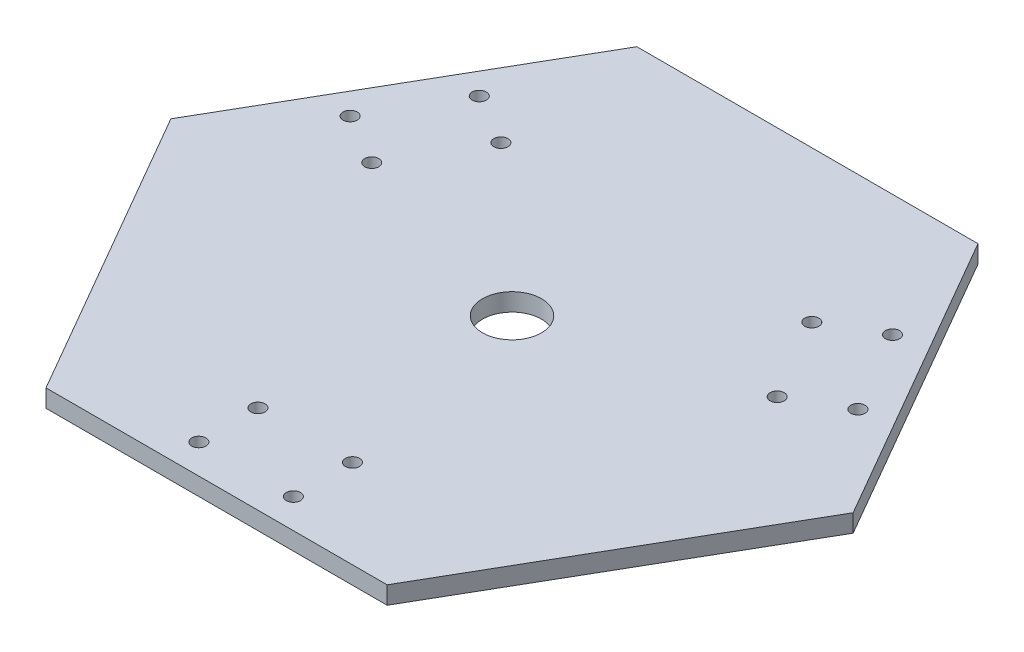
from build123d import *

# Parameters (mm, degrees)
EXTRUDE_1_DEPTH          = 3
SKETCH_2_R               = 5
CUT_EXTRUDE_1_DEPTH      = 3
SKETCH_3_R               = 1.2
CUT_EXTRUDE_2_DEPTH      = 3
PATTERN_CIRCULAR_1_COUNT = 3


with BuildPart() as part:
    # 草图1 → 凸台-拉伸1 (new body)
    with BuildSketch(Plane(origin=(0, 0, 0), x_dir=(1, 0, 0), z_dir=(0, 1, 0))):
        Polygon((28.867513459, 50), (-28.867513459, 50), (-57.735026919, 0), (-28.867513459, -50), (28.867513459, -50), (57.735026919, 0), align=None)
    extrude(amount=EXTRUDE_1_DEPTH)

    # 草图2 → 切除-拉伸1 (cut)
    with BuildSketch(Plane(origin=(0, 3, 0), x_dir=(1, 0, 0), z_dir=(0, 1, 0))):
        with Locations(Location((0, 0, 0), (0, 0, 270))):
            Circle(SKETCH_2_R)
    extrude(amount=-CUT_EXTRUDE_1_DEPTH, mode=Mode.SUBTRACT)

    # 草图3 → 切除-拉伸2 (cut)
    with BuildSketch(Plane.XZ):
        with Locations(Location((-8, 45, 0), (0, 0, 270))):
            Circle(SKETCH_3_R)
        with Locations(Location((8, 45, 0), (0, 0, 270))):
            Circle(SKETCH_3_R)
        with Locations(Location((8, 35, 0), (0, 0, 270))):
            Circle(SKETCH_3_R)
        with Locations(Location((-8, 35, 0), (0, 0, 270))):
            Circle(SKETCH_3_R)
    cut_extrude_2 = extrude(amount=-CUT_EXTRUDE_2_DEPTH, mode=Mode.SUBTRACT)

    # 阵列(圆周)1: 切除-拉伸2 ×3 about axis
    pattern_circular_1_axis = Axis((0, 0, 0), (0, 1, 0))
    for i in range(1, PATTERN_CIRCULAR_1_COUNT):
        add(cut_extrude_2.rotate(pattern_circular_1_axis, i * 360 / PATTERN_CIRCULAR_1_COUNT), mode=Mode.SUBTRACT)


solid = part.part
